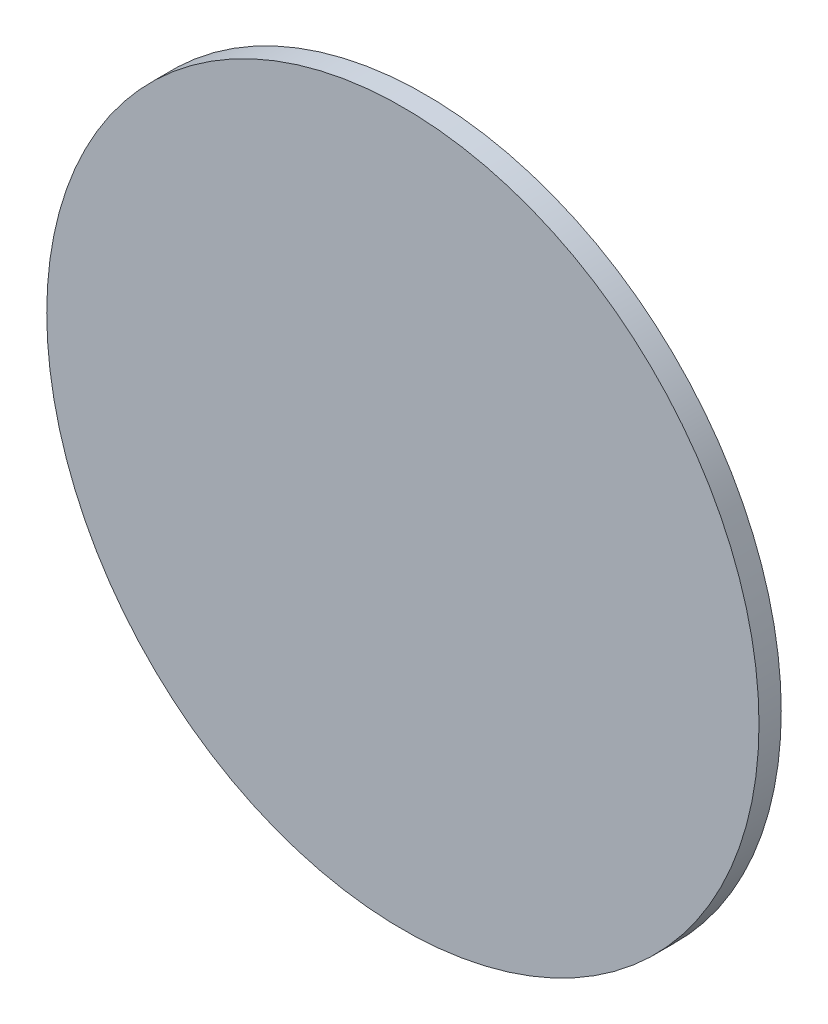
from build123d import *

# Parameters (mm, degrees)
SKETCH1_R           = 16
BOSS_EXTRUDE1_DEPTH = 1


with BuildPart() as part:
    # Sketch1 → Boss-Extrude1 (new body)
    with BuildSketch(Plane(origin=(0, 0, 0), x_dir=(-1, 0, 0), z_dir=(0, 0, -1))):
        Circle(SKETCH1_R)
    extrude(amount=-BOSS_EXTRUDE1_DEPTH)


solid = part.part
